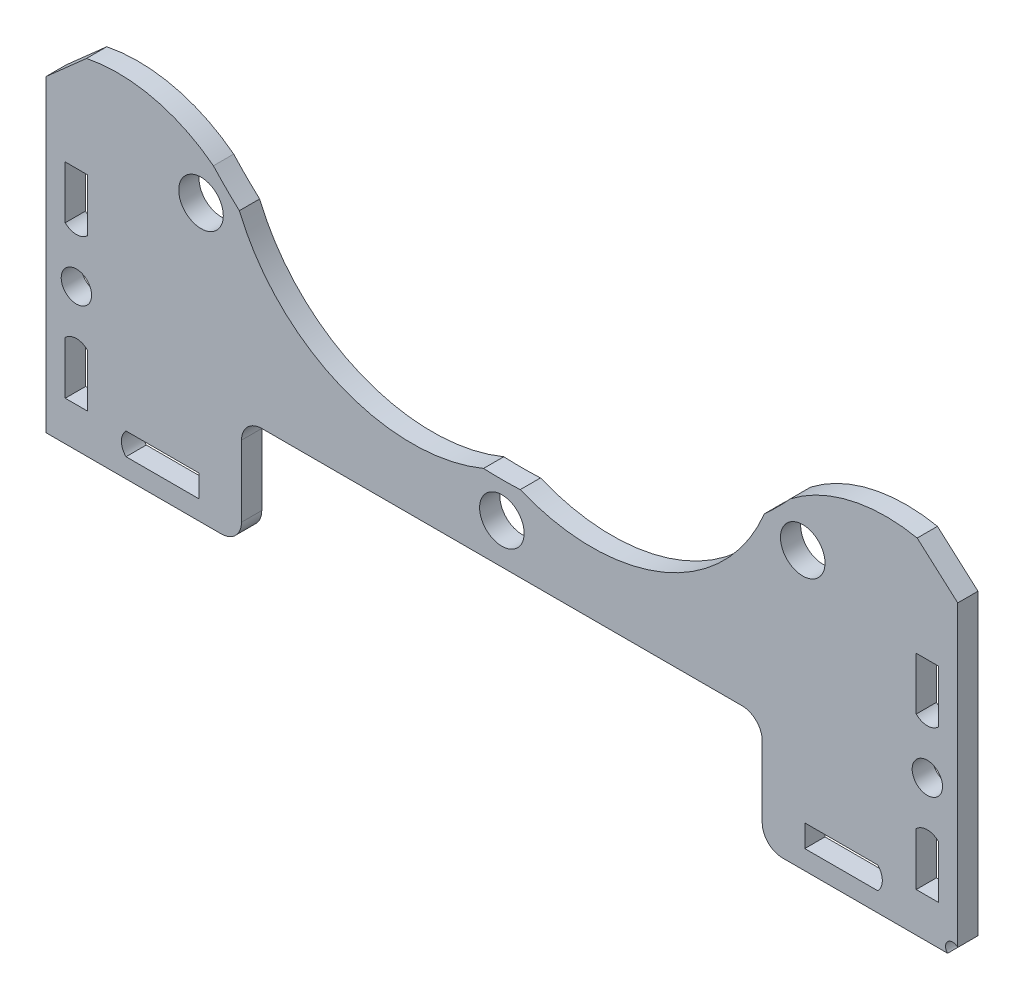
from build123d import *

# Parameters (mm, degrees)
SKETCH_3_R      = 1.5
SKETCH_3_R_2    = 2.2
EXTRUDE_1_DEPTH = 2


with BuildPart() as part:
    # 草图3 → 凸台-拉伸1 (new body)
    with BuildSketch(Plane.XY):
        with BuildLine():
            Line((-41, -3.990216685), (-42, -3.990216685))
            Line((-42, -3.990216685), (-44, -3.990216685))
            Line((-44, -3.990216685), (-45, -3.990216685))
            Line((-45, -3.990216685), (-45, 5.009783315))
            Line((-45, 5.009783315), (-45, 15.009783315))
            Line((-45, 15.009783315), (-45, 26.463053661))
            Line((-45, 26.463053661), (-41, 30.009783315))
            ThreePointArc((-41, 30.009783315), (-34.419700864, 29.918417158), (-28.474223712, 27.097072458))
            ThreePointArc((-28.474223712, 27.097072458), (-27.224142461, 25.786703646), (-25.913822442, 24.53657125))
            ThreePointArc((-25.913822442, 24.53657125), (-15.930575492, 14.552804361), (-1.811764606, 14.552436817))
            ThreePointArc((-1.811764606, 14.552436817), (0, 14.509783437), (1.811764606, 14.552436817))
            ThreePointArc((1.811764606, 14.552436817), (15.930575492, 14.552804361), (25.913822442, 24.53657125))
            ThreePointArc((25.913822442, 24.53657125), (27.224142461, 25.786703646), (28.474223712, 27.097072458))
            ThreePointArc((28.474223712, 27.097072458), (34.419700864, 29.918417158), (41, 30.009783315))
            Line((41, 30.009783315), (45, 26.463053661))
            Line((45, 26.463053661), (45, 15.009783315))
            Line((45, 15.009783315), (45, 5.009783315))
            Line((45, 5.009783315), (45, -2.990216685))
            ThreePointArc((45, -2.990216685), (44, -2.990216685), (44, -3.990216685))
            Line((44, -3.990216685), (41, -3.990216685))
            Line((41, -3.990216685), (27.7, -3.990216685))
            ThreePointArc((27.7, -3.990216685), (26.285786438, -3.404430248), (25.7, -1.990216685))
            Line((25.7, -1.990216685), (25.7, 5.024732502))
            ThreePointArc((25.7, 5.024732502), (25.114213562, 6.438946065), (23.7, 7.024732502))
            Line((23.7, 7.024732502), (-23.7, 7.024732502))
            ThreePointArc((-23.7, 7.024732502), (-25.114213562, 6.438946065), (-25.7, 5.024732502))
            Line((-25.7, 5.024732502), (-25.7, -1.990216685))
            ThreePointArc((-25.7, -1.990216685), (-26.285786438, -3.404430248), (-27.7, -3.990216685))
            Line((-27.7, -3.990216685), (-41, -3.990216685))
        make_face()
        with Locations((42, 10.009783315)):
            Circle(SKETCH_3_R, mode=Mode.SUBTRACT)
        with Locations(Location((-42, 10.009783315, 0), (0, 0, 180))):
            Circle(SKETCH_3_R, mode=Mode.SUBTRACT)
        with Locations((0, 11.009783312)):
            Circle(SKETCH_3_R_2, mode=Mode.SUBTRACT)
        with Locations((-29.69848481, 23.311298502)):
            Circle(SKETCH_3_R_2, mode=Mode.SUBTRACT)
        with Locations((29.69848481, 23.311298502)):
            Circle(SKETCH_3_R_2, mode=Mode.SUBTRACT)
        with BuildLine():
            Line((-37.1, -2.090216685), (-29.9, -2.090216685))
            Line((-29.9, -2.090216685), (-29.9, 0.109783315))
            Line((-29.9, 0.109783315), (-37.1, 0.109783315))
            ThreePointArc((-37.1, 0.109783315), (-37.555634919, -0.990216685), (-37.1, -2.090216685))
        make_face(mode=Mode.SUBTRACT)
        with BuildLine():
            Line((29.9, -2.090216685), (29.9, 0.109783315))
            Line((29.9, 0.109783315), (37.1, 0.109783315))
            ThreePointArc((37.1, 0.109783315), (37.555634919, -0.990216685), (37.1, -2.090216685))
            Line((37.1, -2.090216685), (29.9, -2.090216685))
        make_face(mode=Mode.SUBTRACT)
        with BuildLine():
            Line((-43.1, 5.109783315), (-43.1, -0.090216685))
            Line((-43.1, -0.090216685), (-40.9, -0.090216685))
            Line((-40.9, -0.090216685), (-40.9, 5.109783315))
            ThreePointArc((-40.9, 5.109783315), (-42, 5.565418233), (-43.1, 5.109783315))
        make_face(mode=Mode.SUBTRACT)
        with BuildLine():
            Line((-43.1, 20.109783315), (-40.9, 20.109783315))
            Line((-40.9, 20.109783315), (-40.9, 14.909783315))
            ThreePointArc((-40.9, 14.909783315), (-42, 14.454148396), (-43.1, 14.909783315))
            Line((-43.1, 14.909783315), (-43.1, 20.109783315))
        make_face(mode=Mode.SUBTRACT)
        with BuildLine():
            Line((40.9, 20.109783315), (40.9, 14.909783315))
            ThreePointArc((40.9, 14.909783315), (42, 14.454148396), (43.1, 14.909783315))
            Line((43.1, 14.909783315), (43.1, 20.109783315))
            Line((43.1, 20.109783315), (40.9, 20.109783315))
        make_face(mode=Mode.SUBTRACT)
        with BuildLine():
            Line((40.9, 5.109783315), (40.9, -0.090216685))
            Line((40.9, -0.090216685), (43.1, -0.090216685))
            Line((43.1, -0.090216685), (43.1, 5.109783315))
            ThreePointArc((43.1, 5.109783315), (42, 5.565418233), (40.9, 5.109783315))
        make_face(mode=Mode.SUBTRACT)
    extrude(amount=EXTRUDE_1_DEPTH)


solid = part.part
